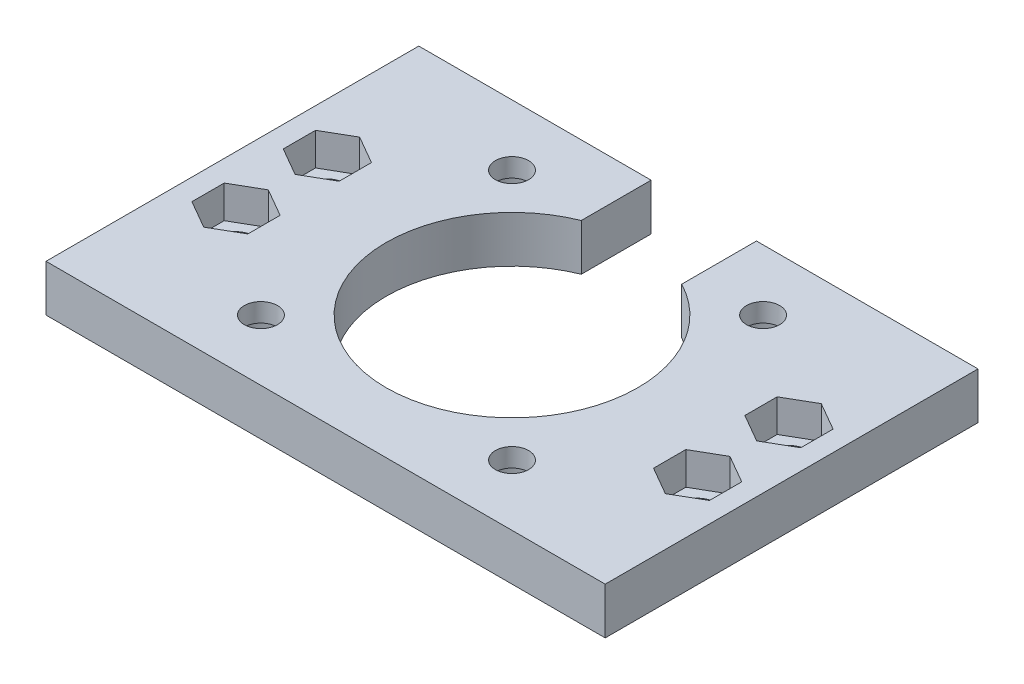
from build123d import *

# Parameters (mm, degrees)
SKETCH1_W           = 60
SKETCH1_H           = 40
BOSS_EXTRUDE1_DEPTH = 5
SKETCH2_R           = 1.78
SKETCH2_R_2         = 1.905
CUT_EXTRUDE1_DEPTH  = 10
CUT_EXTRUDE2_DEPTH  = 73.284161474
SKETCH7_R           = 4.5
CUT_EXTRUDE5_DEPTH  = 3
CUT_EXTRUDE6_DEPTH  = 3.5


with BuildPart() as part:
    # Sketch1 → Boss-Extrude1 (new body)
    with BuildSketch(Plane(origin=(0, 0, 0), x_dir=(1, 0, 0), z_dir=(0, 1, 0))):
        with Locations((30, 20)):
            Rectangle(SKETCH1_W, SKETCH1_H)
    extrude(amount=BOSS_EXTRUDE1_DEPTH)

    # Sketch2 → Cut-Extrude1 (cut)
    with BuildSketch(Plane(origin=(0, 5, 0), x_dir=(1, 0, 0), z_dir=(0, 1, 0))):
        with Locations(Location((43.47, 33.47, 0), (0, 0, 270))):
            Circle(SKETCH2_R)
        with Locations(Location((16.53, 33.47, 0), (0, 0, 270))):
            Circle(SKETCH2_R)
        with Locations(Location((16.53, 6.53, 0), (0, 0, 270))):
            Circle(SKETCH2_R)
        with Locations(Location((43.47, 6.53, 0), (0, 0, 270))):
            Circle(SKETCH2_R)
        with Locations(Location((54.818710608, 24.9, 0), (0, 0, 270))):
            Circle(SKETCH2_R_2)
        with Locations(Location((5.288710608, 24.9, 0), (0, 0, 270))):
            Circle(SKETCH2_R_2)
        with Locations(Location((5.288710608, 15.1, 0), (0, 0, 270))):
            Circle(SKETCH2_R_2)
        with Locations(Location((54.818710608, 15.1, 0), (0, 0, 270))):
            Circle(SKETCH2_R_2)
    extrude(amount=-CUT_EXTRUDE1_DEPTH, mode=Mode.SUBTRACT)

    # Sketch3 → Cut-Extrude2 (cut, through all)
    with BuildSketch(Plane(origin=(0, 5, 0), x_dir=(1, 0, 0), z_dir=(0, 1, 0))):
        with BuildLine():
            ThreePointArc((36.230094697, 31.976473607), (33.206836939, 33.113588252), (30, 33.5))
            Line((30, 33.5), (30, 27.34780867))
            Line((30, 27.34780867), (36.230094697, 27.34780867))
            Line((36.230094697, 27.34780867), (36.230094697, 31.976473607))
        make_face()
        with BuildLine():
            Line((36.230094697, 27.34780867), (30, 27.34780867))
            Line((30, 27.34780867), (30, 6.5))
            ThreePointArc((30, 6.5), (39.545941546, 10.454058454), (43.5, 20))
            ThreePointArc((43.5, 20), (41.540283324, 27.005131033), (36.230094697, 31.976473607))
            Line((36.230094697, 31.976473607), (36.230094697, 27.34780867))
        make_face()
        with BuildLine():
            Line((30, 27.34780867), (30, 33.5))
            ThreePointArc((30, 33.5), (27.414652789, 33.250131312), (24.925008883, 32.509774785))
            Line((24.925008883, 32.509774785), (24.925008883, 27.34780867))
            Line((24.925008883, 27.34780867), (30, 27.34780867))
        make_face()
        with BuildLine():
            Line((30, 6.5), (30, 27.34780867))
            Line((30, 27.34780867), (24.925008883, 27.34780867))
            Line((24.925008883, 27.34780867), (24.925008883, 32.509774785))
            ThreePointArc((24.925008883, 32.509774785), (16.749868688, 17.414652789), (30, 6.5))
        make_face()
        with BuildLine():
            Line((36.230094697, 40), (30, 40))
            Line((30, 40), (30, 33.5))
            ThreePointArc((30, 33.5), (33.206836939, 33.113588252), (36.230094697, 31.976473607))
            Line((36.230094697, 31.976473607), (36.230094697, 40))
        make_face()
        with BuildLine():
            Line((30, 33.5), (30, 40))
            Line((30, 40), (24.925008883, 40))
            Line((24.925008883, 40), (24.925008883, 32.509774785))
            ThreePointArc((24.925008883, 32.509774785), (27.414652789, 33.250131312), (30, 33.5))
        make_face()
    extrude(amount=-CUT_EXTRUDE2_DEPTH, mode=Mode.SUBTRACT)

    # Sketch7 → Cut-Extrude5 (cut)
    with BuildSketch(Plane(origin=(0, 0, 0), x_dir=(-1, 0, 0), z_dir=(0, -1, 0))):
        with Locations(Location((-43.47, 6.53, 0), (0, 0, 90))):
            Circle(SKETCH7_R)
        with Locations(Location((-16.53, 6.53, 0), (0, 0, 90))):
            Circle(SKETCH7_R)
        with Locations(Location((-16.53, 33.47, 0), (0, 0, 90))):
            Circle(SKETCH7_R)
        with Locations(Location((-43.47, 33.47, 0), (0, 0, 90))):
            Circle(SKETCH7_R)
    extrude(amount=-CUT_EXTRUDE5_DEPTH, mode=Mode.SUBTRACT)

    # Sketch8 → Cut-Extrude6 (cut)
    with BuildSketch(Plane(origin=(0, 5, 0), x_dir=(1, 0, 0), z_dir=(0, 1, 0))):
        Polygon((5.288710608, 18.564101615), (2.288710608, 16.832050808), (2.288710608, 13.367949192), (5.288710608, 11.635898385), (8.288710608, 13.367949192), (8.288710608, 16.832050808), align=None)
        Polygon((54.818710608, 11.635898385), (57.818710608, 13.367949192), (57.818710608, 16.832050808), (54.818710608, 18.564101615), (51.818710608, 16.832050808), (51.818710608, 13.367949192), align=None)
        Polygon((5.288710608, 28.364101615), (2.288710608, 26.632050808), (2.288710608, 23.167949192), (5.288710608, 21.435898385), (8.288710608, 23.167949192), (8.288710608, 26.632050808), align=None)
        Polygon((54.818710608, 28.364101615), (51.818710608, 26.632050808), (51.818710608, 23.167949192), (54.818710608, 21.435898385), (57.818710608, 23.167949192), (57.818710608, 26.632050808), align=None)
    extrude(amount=-CUT_EXTRUDE6_DEPTH, mode=Mode.SUBTRACT)


solid = part.part
